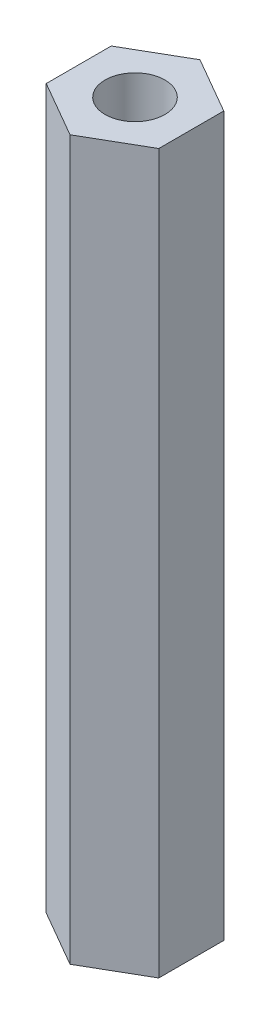
from build123d import *

# Parameters (mm, degrees)
SKETCH1_R           = 1.5
BOSS_EXTRUDE1_DEPTH = 6
BOSS_EXTRUDE2_DEPTH = 30
SKETCH3_R           = 1.25
CUT_EXTRUDE1_DEPTH  = 37.178527241
SKETCH4_R           = 1.753983447
CUT_EXTRUDE2_DEPTH  = 10


with BuildPart() as part:
    # Sketch1 → Boss-Extrude1 (new body)
    with BuildSketch(Plane(origin=(0, 0, 0), x_dir=(1, 0, 0), z_dir=(0, 1, 0))):
        Circle(SKETCH1_R)
    extrude(amount=BOSS_EXTRUDE1_DEPTH)

    # Sketch2 → Boss-Extrude2 (add)
    with BuildSketch(Plane(origin=(0, 6, 0), x_dir=(1, 0, 0), z_dir=(0, 1, 0))):
        Polygon((-2.35, 1.356773133), (-2.35, -1.356773133), (0, -2.713546265), (2.35, -1.356773133), (2.35, 1.356773133), (0, 2.713546265), align=None)
    extrude(amount=BOSS_EXTRUDE2_DEPTH)

    # Sketch3 → Cut-Extrude1 (cut, through all)
    with BuildSketch(Plane(origin=(0, 36, 0), x_dir=(1, 0, 0), z_dir=(0, 1, 0))):
        Circle(SKETCH3_R)
    extrude(amount=-CUT_EXTRUDE1_DEPTH, mode=Mode.SUBTRACT)

    # Sketch4 → Cut-Extrude2 (cut)
    with BuildSketch(Plane.XZ.offset(-6)):
        Circle(SKETCH4_R)
    extrude(amount=CUT_EXTRUDE2_DEPTH, mode=Mode.SUBTRACT)


solid = part.part
